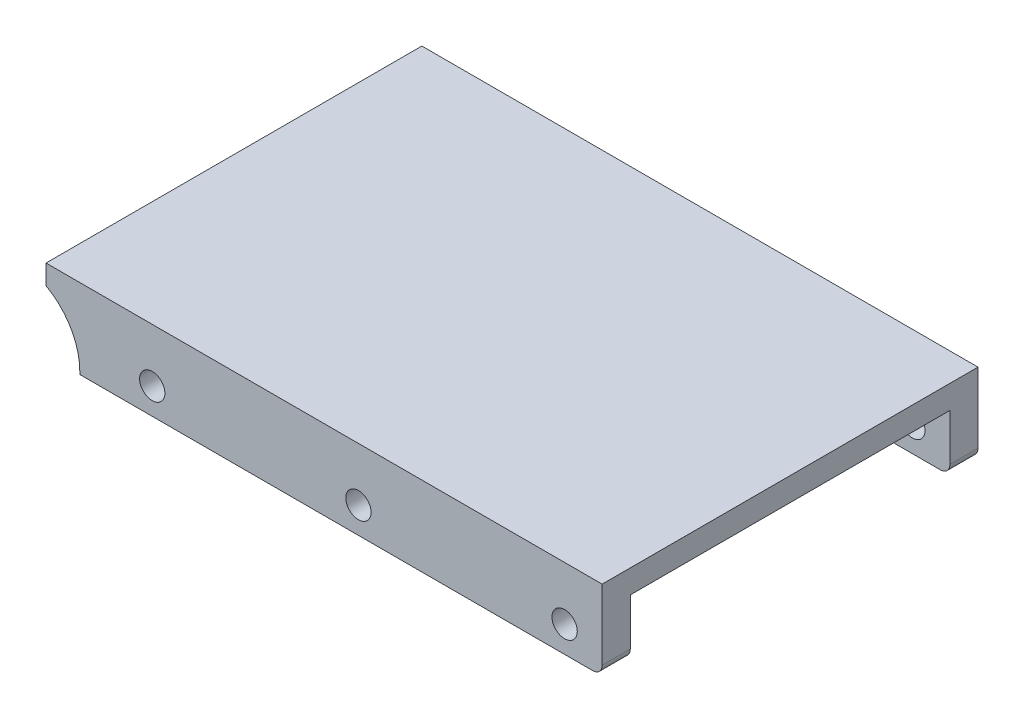
from build123d import *

# Parameters (mm, degrees)
BOSS_EXTRUDE1_DEPTH = 40.1
SKETCH3_R           = 1.35
CUT_EXTRUDE2_DEPTH  = 50.8
SKETCH4_R           = 1.016
CUT_EXTRUDE3_DEPTH  = 50.8
SKETCH6_W           = 62.086073973
SKETCH6_H           = 34.1
CUT_EXTRUDE4_DEPTH  = 6
BOSS_EXTRUDE5_DEPTH = 2
FILLET1_R           = 1
SKETCH17_W          = 87.972052268
SKETCH17_H          = 62.392444702
CUT_EXTRUDE5_DEPTH  = 101.73954578
SKETCH18_W          = 11.938
SKETCH18_H          = 8.5
CUT_EXTRUDE6_DEPTH  = 87.3496381
SKETCH19_W          = 9.553882118
SKETCH19_H          = 7.100488973
BOSS_EXTRUDE6_DEPTH = 40
SKETCH20_W          = 8.332283041
SKETCH20_H          = 7.273954642
CUT_EXTRUDE8_DEPTH  = 87.3496381
FILLET2_R           = 7
SKETCH21_W          = 4.7244
SKETCH21_H          = 10
CUT_EXTRUDE9_DEPTH  = 87.3496381
SKETCH22_W          = 34.1
SKETCH22_H          = 6
CUT_EXTRUDE10_DEPTH = 69.201135731


with BuildPart() as part:
    # Sketch1 → Boss-Extrude1 (new body)
    with BuildSketch(Plane.XY):
        Polygon((0, 0), (0, 52.578), (6, 52.578), (6, 8.5), (76, 8.5), (76, 0), align=None)
    extrude(amount=BOSS_EXTRUDE1_DEPTH)

    # Sketch3 → Cut-Extrude2 (cut)
    with BuildSketch(Plane.XY.offset(40.1)):
        with Locations((27.996, 2.8)):
            Circle(SKETCH3_R)
        with Locations((49.996, 2.8)):
            Circle(SKETCH3_R)
        with Locations((71.996, 2.8)):
            Circle(SKETCH3_R)
    extrude(amount=-CUT_EXTRUDE2_DEPTH, mode=Mode.SUBTRACT)

    # Sketch4 → Cut-Extrude3 (cut)
    with BuildSketch(Plane.ZY):
        with Locations((27.88, 17.6)):
            Circle(SKETCH4_R)
        with Locations(Location((11.88, 17.6, 0), (0, 0, 270))):
            Circle(SKETCH4_R)
        with Locations((27.88, 49.6)):
            Circle(SKETCH4_R)
        with Locations(Location((11.88, 49.6, 0), (0, 0, 270))):
            Circle(SKETCH4_R)
    extrude(amount=-CUT_EXTRUDE3_DEPTH, mode=Mode.SUBTRACT)

    # Sketch6 → Cut-Extrude4 (cut)
    with BuildSketch(Plane.XZ):
        with Locations((50.043036987, 20.05)):
            Rectangle(SKETCH6_W, SKETCH6_H)
    extrude(amount=-CUT_EXTRUDE4_DEPTH, mode=Mode.SUBTRACT)

    # Sketch16 → Boss-Extrude5 (add)
    with BuildSketch(Plane.XY.offset(40.1)):
        Polygon((6, 8.5), (26, 8.5), (6, 33.5), align=None)
    boss_extrude5 = extrude(amount=-BOSS_EXTRUDE5_DEPTH)

    # Mirror2: Boss-Extrude5 across plane
    add(boss_extrude5.mirror(Plane(origin=(0, 0, 20.05), x_dir=(1, 0, 0), z_dir=(0, 0, -1))))

    # Fillet1
    fillet1_edges = [part.edges().sort_by_distance(p)[0] for p in [
        (0, 0, 20.05),
        (76, 0, 38.6),
        (3, 52.578, 40.1),
        (76, 0, 1.5),
        (3, 52.578, 0),
    ]]
    fillet(fillet1_edges, radius=FILLET1_R)

    # Sketch17 → Cut-Extrude5 (cut, through all)
    with BuildSketch(Plane.XY.offset(40.1)):
        with Locations((43.986026134, 39.696222351)):
            Rectangle(SKETCH17_W, SKETCH17_H)
    extrude(amount=-CUT_EXTRUDE5_DEPTH, mode=Mode.SUBTRACT)

    # Sketch18 → Cut-Extrude6 (cut, through all)
    with BuildSketch(Plane.XY.offset(40.1)):
        with Locations((5.969, 4.25)):
            Rectangle(SKETCH18_W, SKETCH18_H)
    extrude(amount=-CUT_EXTRUDE6_DEPTH, mode=Mode.SUBTRACT)

    # Sketch19 → Boss-Extrude6 (add)
    with BuildSketch(Plane.XY.offset(40.1)):
        with Locations((16.714941059, 3.550244487)):
            Rectangle(SKETCH19_W, SKETCH19_H)
    extrude(amount=-BOSS_EXTRUDE6_DEPTH)

    # Sketch20 → Cut-Extrude8 (cut, through all)
    with BuildSketch(Plane.XY.offset(40.1)):
        with Locations((16.104141521, 3.636977321)):
            Rectangle(SKETCH20_W, SKETCH20_H)
    extrude(amount=-CUT_EXTRUDE8_DEPTH, mode=Mode.SUBTRACT)

    # Fillet2
    fillet2_edges = [part.edges().sort_by_distance(p)[0] for p in [
        (20.270283041, 7.273954642, 20.05),
    ]]
    fillet(fillet2_edges, radius=FILLET2_R)

    # Sketch21 → Cut-Extrude9 (cut, through all)
    with BuildSketch(Plane.XY.offset(40.1)):
        with Locations((14.3002, 3.5)):
            Rectangle(SKETCH21_W, SKETCH21_H)
    extrude(amount=-CUT_EXTRUDE9_DEPTH, mode=Mode.SUBTRACT)

    # Sketch22 → Cut-Extrude10 (cut, through all)
    with BuildSketch(Plane(origin=(21.491882118, 0, 0), x_dir=(0, 0, -1), z_dir=(1, 0, 0))):
        with Locations((-20.05, 3)):
            Rectangle(SKETCH22_W, SKETCH22_H)
    extrude(amount=-CUT_EXTRUDE10_DEPTH, mode=Mode.SUBTRACT)


solid = part.part
